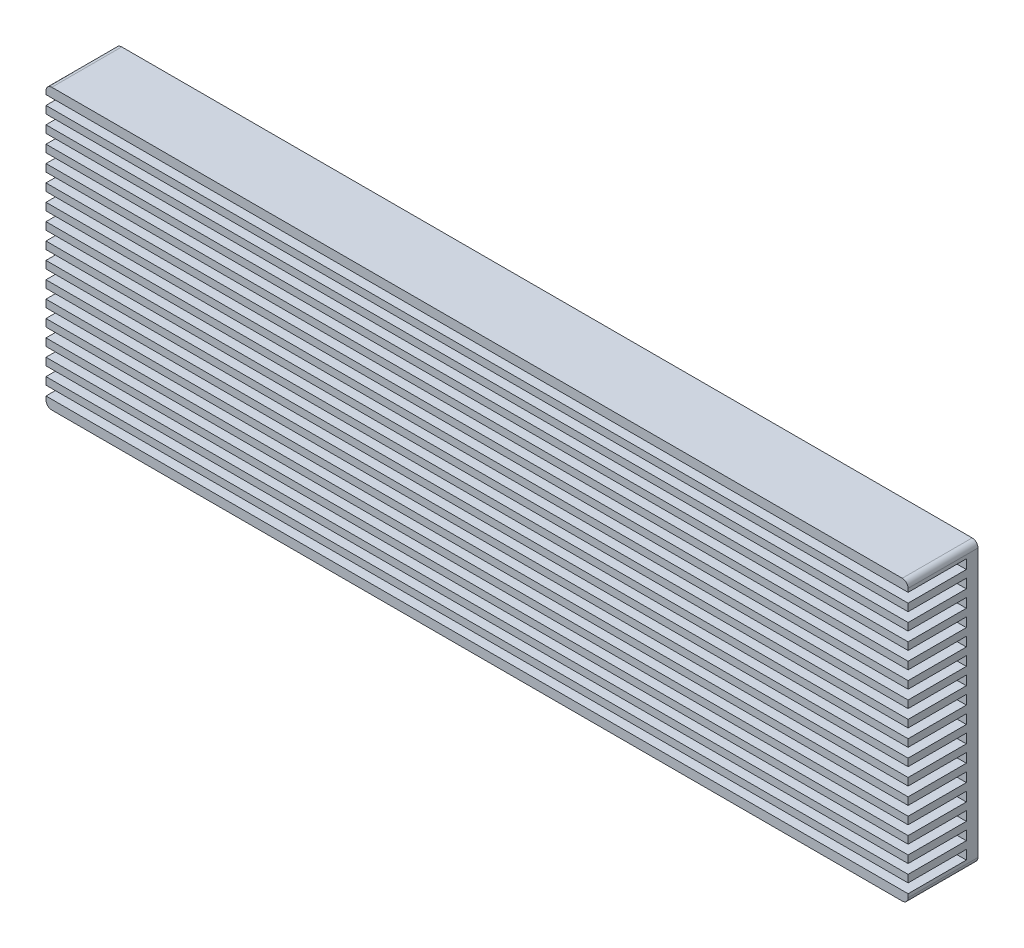
from build123d import *

# Parameters (mm, degrees)
SKETCH_1_W          = 74
SKETCH_1_H          = 24
EXTRUDE_1_DEPTH     = 6
SKETCH_2_W          = 74
SKETCH_2_H          = 0.8
CUT_EXTRUDE_1_DEPTH = 5
FILLET_1_R          = 0.5


with BuildPart() as part:
    # 草图1 → 凸台-拉伸1 (new body)
    with BuildSketch(Plane.XY):
        with Locations((37, -12)):
            Rectangle(SKETCH_1_W, SKETCH_1_H)
    extrude(amount=EXTRUDE_1_DEPTH)

    # 草图2 → 切除-拉伸1 (cut)
    with BuildSketch(Plane.XY.offset(6)):
        with Locations((37, -22.8)):
            Rectangle(SKETCH_2_W, SKETCH_2_H)
        with Locations((37, -21.36)):
            Rectangle(SKETCH_2_W, SKETCH_2_H)
        with Locations((37, -19.92)):
            Rectangle(SKETCH_2_W, SKETCH_2_H)
        with Locations((37, -18.48)):
            Rectangle(SKETCH_2_W, SKETCH_2_H)
        with Locations((37, -17.04)):
            Rectangle(SKETCH_2_W, SKETCH_2_H)
        with Locations((37, -15.6)):
            Rectangle(SKETCH_2_W, SKETCH_2_H)
        with Locations((37, -14.16)):
            Rectangle(SKETCH_2_W, SKETCH_2_H)
        with Locations((37, -12.72)):
            Rectangle(SKETCH_2_W, SKETCH_2_H)
        with Locations((37, -11.28)):
            Rectangle(SKETCH_2_W, SKETCH_2_H)
        with Locations((37, -9.84)):
            Rectangle(SKETCH_2_W, SKETCH_2_H)
        with Locations((37, -8.4)):
            Rectangle(SKETCH_2_W, SKETCH_2_H)
        with Locations((37, -6.96)):
            Rectangle(SKETCH_2_W, SKETCH_2_H)
        with Locations((37, -5.52)):
            Rectangle(SKETCH_2_W, SKETCH_2_H)
        with Locations((37, -4.08)):
            Rectangle(SKETCH_2_W, SKETCH_2_H)
        with Locations((37, -2.64)):
            Rectangle(SKETCH_2_W, SKETCH_2_H)
        with Locations((37, -1.2)):
            Rectangle(SKETCH_2_W, SKETCH_2_H)
    extrude(amount=-CUT_EXTRUDE_1_DEPTH, mode=Mode.SUBTRACT)

    # 圆角1
    fillet_1_edges = [part.edges().sort_by_distance(p)[0] for p in [
        (0, 0, 3),
        (74, 0, 3),
        (74, -24, 3),
        (0, -24, 3),
    ]]
    fillet(fillet_1_edges, radius=FILLET_1_R)


solid = part.part
